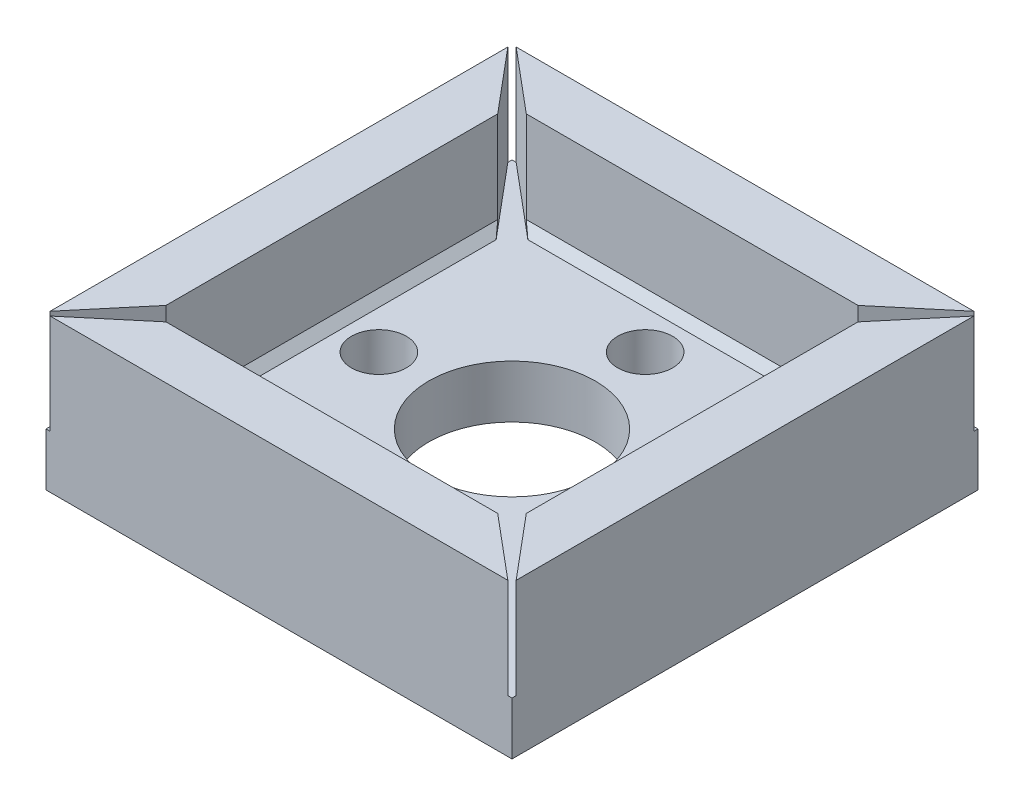
from build123d import *

# Parameters (mm, degrees)
SKETCH1_W                 = 28
SKETCH1_H                 = 28
BOSS_EXTRUDE1_DEPTH       = 3.175
SKETCH2_R                 = 5
CUT_EXTRUDE1_DEPTH        = 21.05194816
F_3_0MM_DOWEL_HOLE1_D     = 3.3
F_3_0MM_DOWEL_HOLE1_DEPTH = 15
F_3_0MM_DOWEL_HOLE1_TIP   = 0.991420021
BOSS_EXTRUDE3_DEPTH       = 6
CIRPATTERN2_COUNT         = 4
CHAMFER2_SIZE             = 0.5


with BuildPart() as part:
    # Sketch1 → Boss-Extrude1 (new body)
    with BuildSketch(Plane(origin=(0, 0, 0), x_dir=(1, 0, 0), z_dir=(0, 1, 0))):
        Rectangle(SKETCH1_W, SKETCH1_H)
    extrude(amount=BOSS_EXTRUDE1_DEPTH)

    # Sketch2 → Cut-Extrude1 (cut, through all)
    with BuildSketch(Plane(origin=(0, 3.175, 0), x_dir=(1, 0, 0), z_dir=(0, 1, 0))):
        with Locations(Location((0, 0, 0), (0, 0, 270))):
            Circle(SKETCH2_R)
    extrude(amount=-CUT_EXTRUDE1_DEPTH, mode=Mode.SUBTRACT)

    # Ø3.0mm Dowel Hole1
    with Locations(Plane(origin=(0, 3.175, 0), x_dir=(1, 0, 0), z_dir=(0, 1, 0))):
        with Locations((8, 0), (0, -8), (-8, 0), (0, 8)):
            Hole(F_3_0MM_DOWEL_HOLE1_D / 2, depth=F_3_0MM_DOWEL_HOLE1_DEPTH)
            with Locations((0, 0, -(F_3_0MM_DOWEL_HOLE1_DEPTH + F_3_0MM_DOWEL_HOLE1_TIP / 2))):  # 118° drill point
                Cone(0, F_3_0MM_DOWEL_HOLE1_D / 2, F_3_0MM_DOWEL_HOLE1_TIP, mode=Mode.SUBTRACT)

    # Sketch7 → Boss-Extrude3 (add)
    with BuildSketch(Plane(origin=(0, 3.175, 0), x_dir=(1, 0, 0), z_dir=(0, 1, 0))):
        Polygon((-13.75, -14), (13.75, -14), (9.966182344, -10.825), (-9.966182344, -10.825), align=None)
    boss_extrude3 = extrude(amount=BOSS_EXTRUDE3_DEPTH)

    # CirPattern2: Boss-Extrude3 ×4 about axis
    cirpattern2_axis = Axis((0, 0, 0), (0, 1, 0))
    for i in range(1, CIRPATTERN2_COUNT):
        add(boss_extrude3.rotate(cirpattern2_axis, i * 360 / CIRPATTERN2_COUNT))

    # Chamfer2
    chamfer2_edges = [part.edges().sort_by_distance(p)[0] for p in [
        (0, 3.175, 10.825),
        (10.825, 3.175, 0),
        (0, 3.175, -10.825),
        (-10.825, 3.175, 0),
    ]]
    chamfer(chamfer2_edges, length=CHAMFER2_SIZE)


solid = part.part
